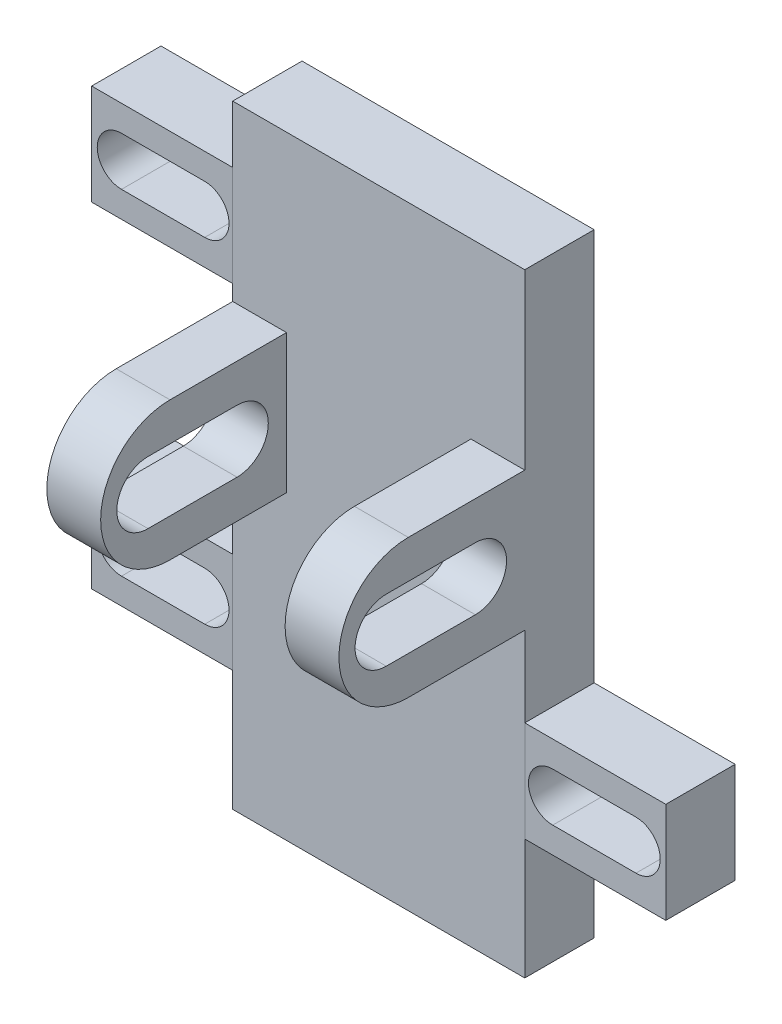
from build123d import *

# Parameters (mm, degrees)
SKETCH1_W           = 21.060518524
SKETCH1_H           = 44.229680595
BOSS_EXTRUDE1_DEPTH = 5
SKETCH2_W           = 5
SKETCH2_H           = 5.75
BOSS_EXTRUDE2_DEPTH = 8
BOSS_EXTRUDE3_DEPTH = 3.8801
CUT_EXTRUDE1_DEPTH  = 8
SKETCH6_W           = 10.169740738
SKETCH6_H           = 7.25
BOSS_EXTRUDE4_DEPTH = 5
SKETCH11_W          = 10.169740738
SKETCH11_H          = 7.25
CUT_EXTRUDE2_DEPTH  = 5


with BuildPart() as part:
    # Sketch1 → Boss-Extrude1 (new body)
    with BuildSketch(Plane.XY):
        with Locations((4671.613089989, -40.729662913)):
            Rectangle(SKETCH1_W, SKETCH1_H)
    extrude(amount=BOSS_EXTRUDE1_DEPTH)

    # Sketch2 → Boss-Extrude2 (add)
    with BuildSketch(Plane(origin=(0, 0, 0), x_dir=(-1, 0, 0), z_dir=(0, 0, -1))):
        with Locations((-4671.621214697, -56.691306655)):
            Rectangle(SKETCH2_W, SKETCH2_H)
    extrude(amount=BOSS_EXTRUDE2_DEPTH)

    # Sketch4 → Boss-Extrude3 (add)
    with BuildSketch(Plane.ZY.offset(-4661.082830727)):
        with BuildLine():
            Line((13.400549781, -31.129223835), (5, -31.129223835))
            Line((5, -31.129223835), (5, -41.129223835))
            Line((5, -41.129223835), (13.400549781, -41.129223835))
            ThreePointArc((13.400549781, -41.129223835), (18.400549781, -36.129223835), (13.400549781, -31.129223835))
        make_face()
    boss_extrude3 = extrude(amount=-BOSS_EXTRUDE3_DEPTH)

    # Sketch5 → Cut-Extrude1 (cut)
    with BuildSketch(Plane(origin=(4664.962930727, 0, 0), x_dir=(0, 0, -1), z_dir=(1, 0, 0))):
        with BuildLine():
            Line((-14.986353963, -33.879223835), (-8.563353453, -33.879223835))
            ThreePointArc((-8.563353453, -33.879223835), (-6.313353453, -36.129223835), (-8.563353453, -38.379223835))
            Line((-8.563353453, -38.379223835), (-14.986353963, -38.379223835))
            ThreePointArc((-14.986353963, -38.379223835), (-17.236353963, -36.129223835), (-14.986353963, -33.879223835))
        make_face()
    cut_extrude1 = extrude(amount=-CUT_EXTRUDE1_DEPTH, mode=Mode.SUBTRACT)

    # Mirror2: Boss-Extrude3, Cut-Extrude1 across plane
    add(boss_extrude3.mirror(Plane.ZY.offset(-4671.613089989)))
    add(cut_extrude1.mirror(Plane.ZY.offset(-4671.613089989)), mode=Mode.SUBTRACT)


with BuildPart() as body_2:
    # Sketch6 → Boss-Extrude4 (new body)
    with BuildSketch(Plane.XY.offset(5)):
        with Locations((4687.22821962, -50.538110101)):
            Rectangle(SKETCH6_W, SKETCH6_H)
        with BuildLine():
            Line((4690.160013161, -52.288360766), (4684.160013167, -52.288110099))
            ThreePointArc((4684.160013167, -52.288110099), (4682.410086279, -50.53803699), (4684.160159389, -48.788110102))
            Line((4684.160159389, -48.788110102), (4690.160159384, -48.788360769))
            ThreePointArc((4690.160159384, -48.788360769), (4691.910086271, -50.538433879), (4690.160013161, -52.288360766))
        make_face(mode=Mode.SUBTRACT)
    extrude(amount=-BOSS_EXTRUDE4_DEPTH)


with BuildPart() as body_3:
    # Mirror3: mirrored copy
    add(body_2.part.mirror(Plane.ZY.offset(-4671.613089989)))


with BuildPart() as body_4:
    # Mirror4: mirrored copy
    add(body_3.part.mirror(Plane(origin=(0, -38.461673776, 0), x_dir=(0, 0, 1), z_dir=(0, -1, 0))))


with BuildPart() as body_5:
    # Mirror4 2: mirrored copy
    add(body_2.part.mirror(Plane(origin=(0, -38.461673776, 0), x_dir=(0, 0, 1), z_dir=(0, -1, 0))))

    # Sketch11 → Cut-Extrude2 (cut)
    with BuildSketch(Plane.XY.offset(5)):
        with Locations((4687.22821962, -26.385237452)):
            Rectangle(SKETCH11_W, SKETCH11_H)
    extrude(amount=-CUT_EXTRUDE2_DEPTH, mode=Mode.SUBTRACT)


solid = Compound([part.part, body_2.part, body_3.part, body_4.part])
